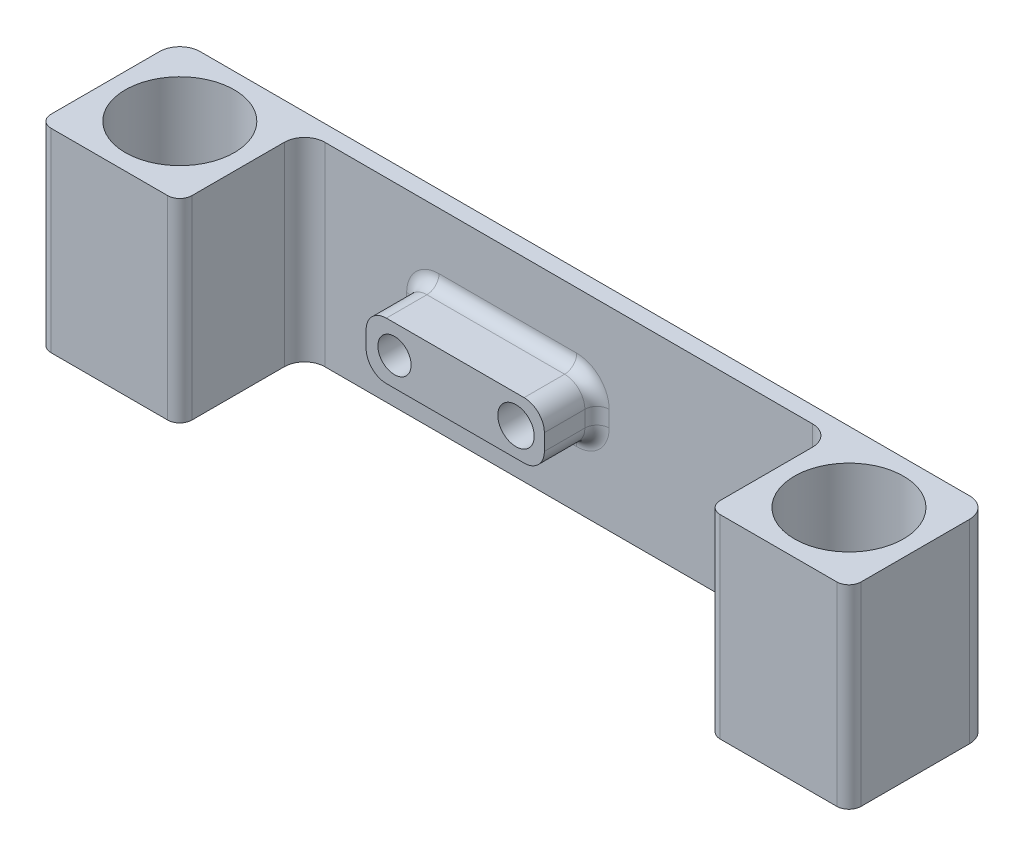
from build123d import *

# Parameters (mm, degrees)
SKETCH1_R           = 13.45
BOSS_EXTRUDE2_DEPTH = 48
SKETCH7_W           = 44
SKETCH7_H           = 14
SKETCH7_R           = 4.5
SKETCH7_R_2         = 4.1
BOSS_EXTRUDE3_DEPTH = 13
FILLET1_R           = 3
FILLET2_R           = 5
FILLET3_R           = 5
FILLET4_R           = 3
SKETCH8_R           = 4.1
SKETCH8_R_2         = 4.5
CUT_EXTRUDE1_DEPTH  = 192.299242027


with BuildPart() as part:
    # Sketch1 → Boss-Extrude2 (new body)
    with BuildSketch(Plane(origin=(0, 0, 0), x_dir=(1, 0, 0), z_dir=(0, 1, 0))):
        Polygon((-17.4, 17.4), (17.4, 17.4), (17.4, -17.4), (-17.4, -17.4), (-17.4, 13.4), (-82.6, 13.4), (-82.6, 17.4), align=None)
        with Locations(Location((0, 0, 0), (0, 0, 270))):
            Circle(SKETCH1_R, mode=Mode.SUBTRACT)
    boss_extrude2 = extrude(amount=BOSS_EXTRUDE2_DEPTH)

    # Mirror2: Boss-Extrude2 across plane
    add(boss_extrude2.mirror(Plane(origin=(-82.6, 48, -17.4), x_dir=(0, 0, 1), z_dir=(1, 0, 0))))

    # Sketch7 → Boss-Extrude3 (add)
    with BuildSketch(Plane.XY.offset(-13.4)):
        with Locations((-97.6, 24)):
            Rectangle(SKETCH7_W, SKETCH7_H)
        with Locations(Location((-82.6, 24, 0), (0, 0, 180))):
            Circle(SKETCH7_R, mode=Mode.SUBTRACT)
        with Locations(Location((-112.6, 24, 0), (0, 0, 180))):
            Circle(SKETCH7_R_2, mode=Mode.SUBTRACT)
    extrude(amount=BOSS_EXTRUDE3_DEPTH)

    # Fillet1
    fillet1_edges = [part.edges().sort_by_distance(p)[0] for p in [
        (17.4, 24, 17.4),
        (-17.4, 24, 17.4),
        (-182.6, 24, 17.4),
        (-147.8, 24, 17.4),
    ]]
    fillet(fillet1_edges, radius=FILLET1_R)

    # Fillet2
    fillet2_edges = [part.edges().sort_by_distance(p)[0] for p in [
        (-17.4, 24, -13.4),
        (17.4, 24, -17.4),
        (-182.6, 24, -17.4),
        (-147.8, 24, -13.4),
    ]]
    fillet(fillet2_edges, radius=FILLET2_R)

    # Fillet3
    fillet3_edges = [part.edges().sort_by_distance(p)[0] for p in [
        (-75.6, 17, -6.9),
        (-75.6, 31, -6.9),
        (-119.6, 31, -6.9),
        (-119.6, 17, -6.9),
    ]]
    fillet(fillet3_edges, radius=FILLET3_R)

    # Fillet4
    fillet4_edges = [part.edges().sort_by_distance(p)[0] for p in [
        (-97.6, 31, -13.4),
        (-75.6, 24, -13.4),
        (-97.6, 17, -13.4),
        (-119.6, 24, -13.4),
        (-77.064466094, 29.535533906, -13.4),
        (-77.064466094, 18.464466094, -13.4),
        (-118.135533906, 29.535533906, -13.4),
        (-118.135533906, 18.464466094, -13.4),
    ]]
    fillet(fillet4_edges, radius=FILLET4_R)

    # Sketch8 → Cut-Extrude1 (cut, through all)
    with BuildSketch(Plane.XY.offset(-13.4)):
        with Locations(Location((-112.6, 24, 0), (0, 0, 180))):
            Circle(SKETCH8_R)
        with Locations(Location((-82.6, 24, 0), (0, 0, 180))):
            Circle(SKETCH8_R_2)
    extrude(amount=-CUT_EXTRUDE1_DEPTH, mode=Mode.SUBTRACT)


solid = part.part
